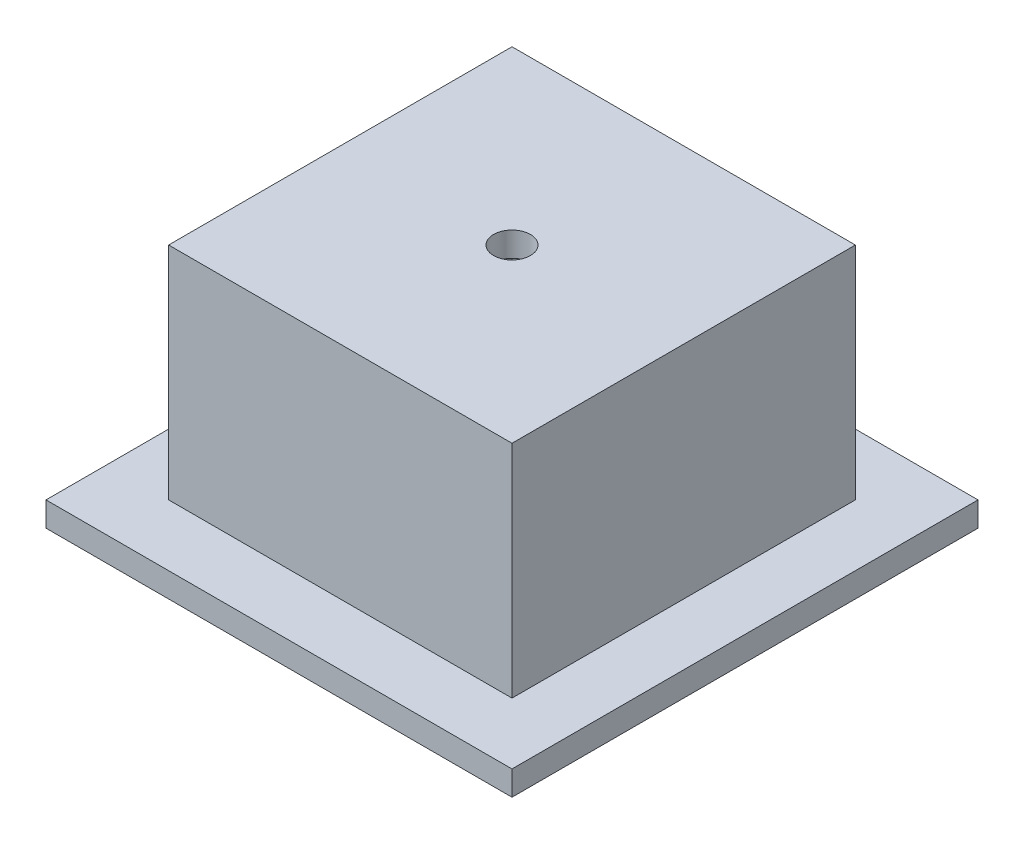
from build123d import *

# Parameters (mm, degrees)
SKETCH1_W           = 71.12
SKETCH1_H           = 71.12
BOSS_EXTRUDE1_DEPTH = 50.8
SKETCH2_W           = 96.52
SKETCH2_H           = 96.52
BOSS_EXTRUDE2_DEPTH = 5.08
SKETCH3_W           = 64.77
SKETCH3_H           = 64.77
CUT_EXTRUDE1_DEPTH  = 45.72
SKETCH4_R           = 3.81
CUT_EXTRUDE2_DEPTH  = 86.08052186


with BuildPart() as part:
    # Sketch1 → Boss-Extrude1 (new body)
    with BuildSketch(Plane(origin=(0, 0, 0), x_dir=(1, 0, 0), z_dir=(0, 1, 0))):
        Rectangle(SKETCH1_W, SKETCH1_H)
    extrude(amount=BOSS_EXTRUDE1_DEPTH)

    # Sketch2 → Boss-Extrude2 (add)
    with BuildSketch(Plane(origin=(0, 0, 0), x_dir=(1, 0, 0), z_dir=(0, 1, 0))):
        Rectangle(SKETCH2_W, SKETCH2_H)
    extrude(amount=BOSS_EXTRUDE2_DEPTH)

    # Sketch3 → Cut-Extrude1 (cut)
    with BuildSketch(Plane.XZ):
        Rectangle(SKETCH3_W, SKETCH3_H)
    extrude(amount=-CUT_EXTRUDE1_DEPTH, mode=Mode.SUBTRACT)

    # Sketch4 → Cut-Extrude2 (cut, through all)
    with BuildSketch(Plane(origin=(0, 50.8, 0), x_dir=(1, 0, 0), z_dir=(0, 1, 0))):
        with Locations(Location((0, 0, 0), (0, 0, 270))):
            Circle(SKETCH4_R)
    extrude(amount=-CUT_EXTRUDE2_DEPTH, mode=Mode.SUBTRACT)


solid = part.part
